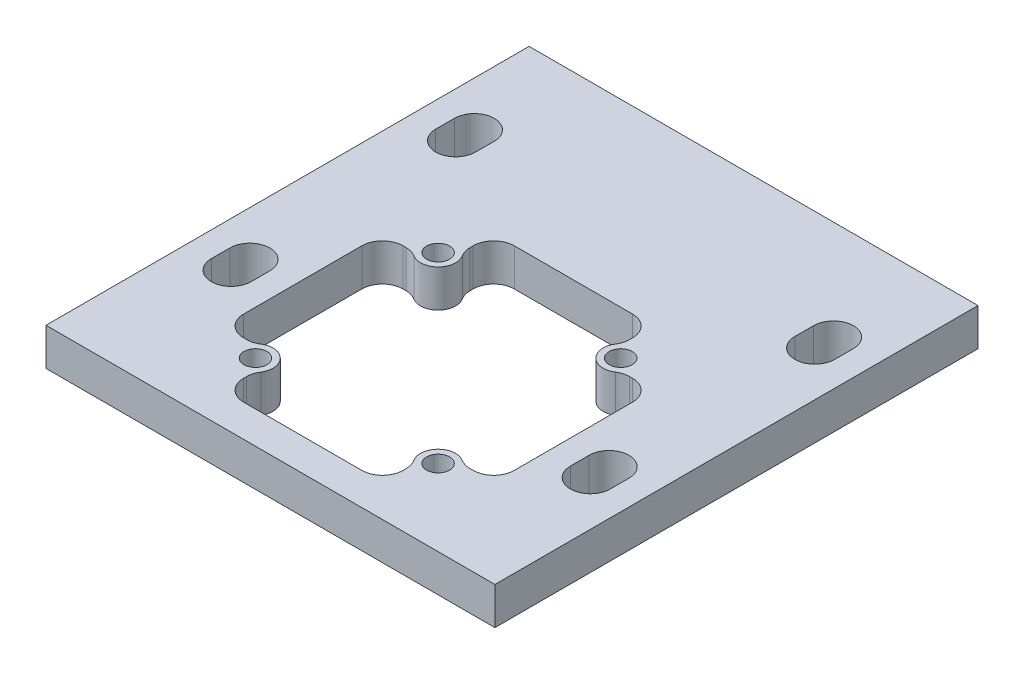
from build123d import *

# Parameters (mm, degrees)
SKETCH1_W              = 76.2
SKETCH1_H              = 82
BOSS_EXTRUDE1_DEPTH    = 3.175
CUT_EXTRUDE2_DEPTH     = 57.328789264
M3_5_CLEARANCE_HOLE1_D = 3.9
CUT_EXTRUDE6_DEPTH     = 57.328789264
CUT_EXTRUDE7_DEPTH     = 57.328789264
CIRPATTERN1_COUNT      = 4


with BuildPart() as part:
    # Sketch1 → Boss-Extrude1 (new, symmetric)
    with BuildSketch(Plane(origin=(0, 0, 0), x_dir=(1, 0, 0), z_dir=(0, 1, 0))):
        Rectangle(SKETCH1_W, SKETCH1_H)
    extrude(amount=BOSS_EXTRUDE1_DEPTH, both=True)

    # Sketch8 → Cut-Extrude2 (cut, through all)
    with BuildSketch(Plane(origin=(0, 3.175, 0), x_dir=(1, 0, 0), z_dir=(0, 1, 0))):
        with BuildLine():
            Line((-33.8582, -17.1875), (-33.8582, -14.0125))
            ThreePointArc((-33.8582, -14.0125), (-30.48, -10.6343), (-27.1018, -14.0125))
            Line((-27.1018, -14.0125), (-27.1018, -17.1875))
            ThreePointArc((-27.1018, -17.1875), (-30.48, -20.5657), (-33.8582, -17.1875))
        make_face()
        with BuildLine():
            Line((-33.8582, 20.9125), (-33.8582, 24.0875))
            ThreePointArc((-33.8582, 24.0875), (-30.48, 27.4657), (-27.1018, 24.0875))
            Line((-27.1018, 24.0875), (-27.1018, 20.9125))
            ThreePointArc((-27.1018, 20.9125), (-30.48, 17.5343), (-33.8582, 20.9125))
        make_face()
    cut_extrude2 = extrude(amount=-CUT_EXTRUDE2_DEPTH, mode=Mode.SUBTRACT)

    # Mirror1: Cut-Extrude2 across plane
    add(cut_extrude2.mirror(Plane(origin=(0, 0, 0), x_dir=(0, 0, 1), z_dir=(1, 0, 0))), mode=Mode.SUBTRACT)

    # M3.5 Clearance Hole1 (through all)
    with Locations(Plane(origin=(0, 3.175, 0), x_dir=(1, 0, 0), z_dir=(0, 1, 0))):
        with Locations((-15.5, 2.951), (15.5, 2.951), (15.5, -28.049), (-15.5, -28.049)):
            Hole(M3_5_CLEARANCE_HOLE1_D / 2)

    # Sketch23 → Cut-Extrude6 (cut, through all)
    with BuildSketch(Plane(origin=(0, 3.175, 0), x_dir=(1, 0, 0), z_dir=(0, 1, 0))):
        with BuildLine():
            Line((-12.9860741, 8.471), (-12.9860741, 4.551180167))
            ThreePointArc((-12.9860741, 4.551180167), (-13.392821792, 0.843821792), (-17.100180167, 0.4370741))
            Line((-17.100180167, 0.4370741), (-21.02, 0.4370741))
            Line((-21.02, 0.4370741), (-21.02, -25.5350741))
            Line((-21.02, -25.5350741), (-17.100180167, -25.5350741))
            ThreePointArc((-17.100180167, -25.5350741), (-13.392821792, -25.941821792), (-12.9860741, -29.649180167))
            Line((-12.9860741, -29.649180167), (-12.9860741, -33.569))
            Line((-12.9860741, -33.569), (12.9860741, -33.569))
            Line((12.9860741, -33.569), (12.9860741, -29.649180167))
            ThreePointArc((12.9860741, -29.649180167), (13.392821792, -25.941821792), (17.100180167, -25.5350741))
            Line((17.100180167, -25.5350741), (21.02, -25.5350741))
            Line((21.02, -25.5350741), (21.02, 0.4370741))
            Line((21.02, 0.4370741), (17.100180167, 0.4370741))
            ThreePointArc((17.100180167, 0.4370741), (13.392821792, 0.843821792), (12.9860741, 4.551180167))
            Line((12.9860741, 4.551180167), (12.9860741, 8.471))
            Line((12.9860741, 8.471), (-12.9860741, 8.471))
        make_face()
    extrude(amount=-CUT_EXTRUDE6_DEPTH, mode=Mode.SUBTRACT)

    # Sketch24 → Cut-Extrude7 (cut, through all)
    with BuildSketch(Plane(origin=(0, 3.175, 0), x_dir=(1, 0, 0), z_dir=(0, 1, 0))):
        with BuildLine():
            Line((-18.979586404, 0.984476566), (-19.479586404, 0.984476566))
            ThreePointArc((-19.479586404, 0.984476566), (-21.954460139, -0.0406497), (-22.979586404, -2.515523434))
            Line((-22.979586404, -2.515523434), (-22.979586404, -22.582476566))
            ThreePointArc((-22.979586404, -22.582476566), (-21.954460139, -25.0573503), (-19.479586404, -26.082476566))
            Line((-19.479586404, -26.082476566), (-18.979586404, -26.082476566))
            ThreePointArc((-18.979586404, -26.082476566), (-18.000834998, -25.942840487), (-17.100180167, -25.5350741))
            ThreePointArc((-17.100180167, -25.5350741), (-13.392821792, -25.941821792), (-12.9860741, -29.649180167))
            Line((-12.9860741, -29.649180167), (-7.9860741, -29.649180167))
            Line((-7.9860741, -29.649180167), (-7.9860741, 4.551180167))
            Line((-7.9860741, 4.551180167), (-12.9860741, 4.551180167))
            ThreePointArc((-12.9860741, 4.551180167), (-13.392821792, 0.843821792), (-17.100180167, 0.4370741))
            ThreePointArc((-17.100180167, 0.4370741), (-18.000834998, 0.844840487), (-18.979586404, 0.984476566))
        make_face()
    cut_extrude7 = extrude(amount=-CUT_EXTRUDE7_DEPTH, mode=Mode.SUBTRACT)

    # CirPattern1: Cut-Extrude7 ×4 about axis
    cirpattern1_axis = Axis((0, 3.175, 12.549), (0, 1, 0))
    for i in range(1, CIRPATTERN1_COUNT):
        add(cut_extrude7.rotate(cirpattern1_axis, i * 360 / CIRPATTERN1_COUNT), mode=Mode.SUBTRACT)


solid = part.part
